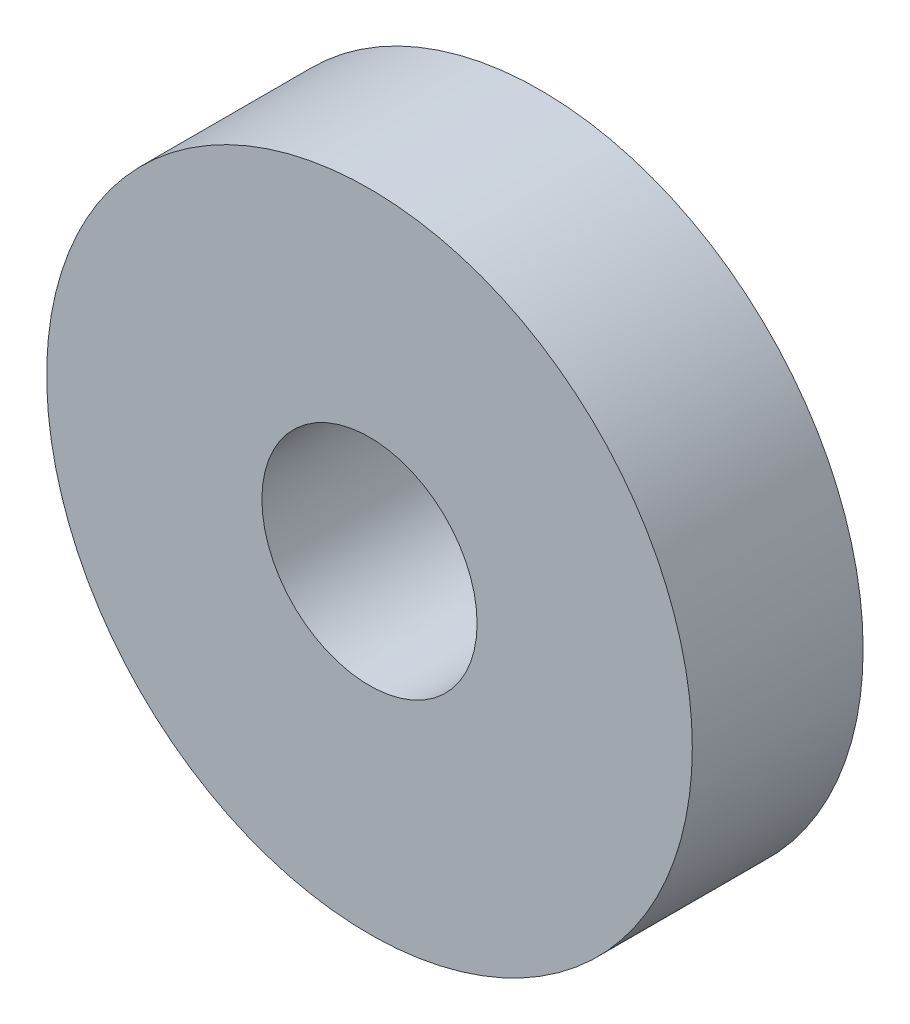
from build123d import *

# Parameters (mm, degrees)
SKETCH1_R           = 6
SKETCH1_R_2         = 2
BOSS_EXTRUDE1_DEPTH = 3.175


with BuildPart() as part:
    # Sketch1 → Boss-Extrude1 (new body)
    with BuildSketch(Plane.XY):
        Circle(SKETCH1_R)
        Circle(SKETCH1_R_2, mode=Mode.SUBTRACT)
    extrude(amount=BOSS_EXTRUDE1_DEPTH)


solid = part.part
